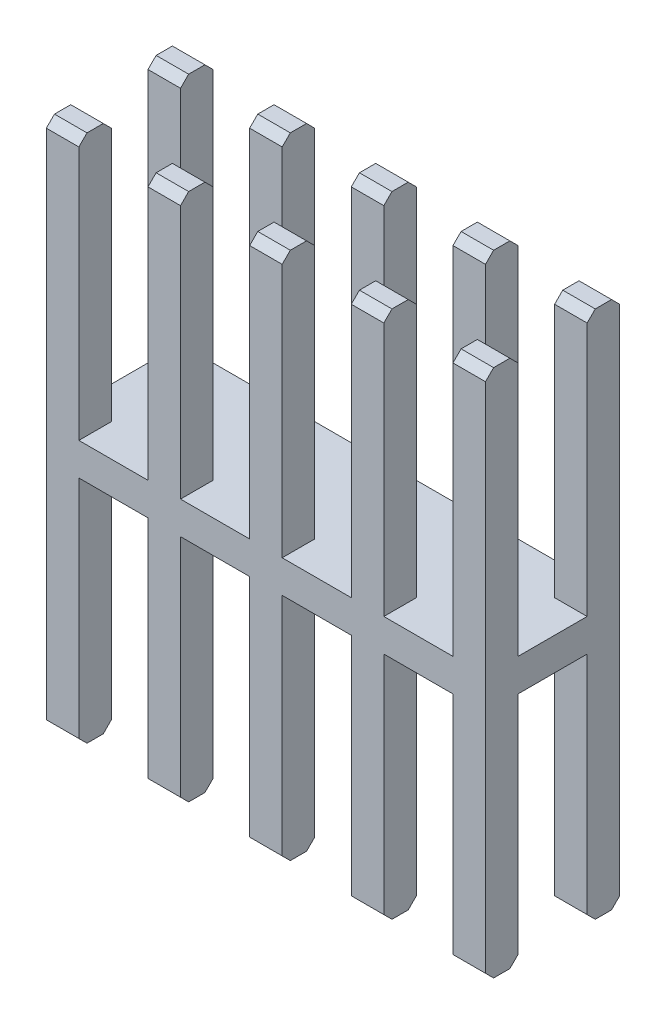
from build123d import *

# Parameters (mm, degrees)
BOSS_EXTRUDE1_DEPTH      = 2.7432
BOSS_EXTRUDE1_DEPTH_BACK = 2.7432
CUT_EXTRUDE1_DEPTH       = 2.794
CUT_EXTRUDE1_DEPTH_BACK  = 2.794
CUT_EXTRUDE2_DEPTH       = 2.794
CUT_EXTRUDE2_DEPTH_BACK  = 2.794


with BuildPart() as part:
    # Sketch1 → Boss-Extrude1 (new, two sides: drawn at the far end of the back side and taken through both)
    with BuildSketch(Plane(origin=(0, 0, 0), x_dir=(0, 0, -1), z_dir=(1, 0, 0)).offset(-BOSS_EXTRUDE1_DEPTH_BACK)):
        Polygon((-0.8382, -1.8034), (-0.7366, -1.905), (-0.5334, -1.905), (-0.4318, -1.8034), (-0.4318, 1.016), (0.4318, 1.016), (0.4318, -1.8034), (0.5334, -1.905), (0.7366, -1.905), (0.8382, -1.8034), (0.8382, 4.5974), (0.7366, 4.699), (0.5334, 4.699), (0.4318, 4.5974), (0.4318, 1.4224), (-0.4318, 1.4224), (-0.4318, 4.5974), (-0.5334, 4.699), (-0.7366, 4.699), (-0.8382, 4.5974), align=None)
    extrude(amount=BOSS_EXTRUDE1_DEPTH + BOSS_EXTRUDE1_DEPTH_BACK)

    # Sketch2 → Cut-Extrude1 (cut, two sides: drawn at the far end of the back side and taken through both)
    with BuildSketch(Plane.XY.offset(-CUT_EXTRUDE1_DEPTH_BACK)):
        Polygon((-3.6068, -2.413), (4.0132, -2.413), (4.0132, -1.905), (3.6068, -1.905), (3.6068, 1.016), (2.7432, 1.016), (2.7432, -1.905), (2.3368, -1.905), (2.3368, 1.016), (1.4732, 1.016), (1.4732, -1.905), (1.0668, -1.905), (1.0668, 1.016), (0.2032, 1.016), (0.2032, -1.905), (-0.2032, -1.905), (-0.2032, 1.016), (-1.0668, 1.016), (-1.0668, -1.905), (-1.4732, -1.905), (-1.4732, 1.016), (-2.3368, 1.016), (-2.3368, -1.905), (-2.7432, -1.905), (-2.7432, 1.016), (-3.6068, 1.016), align=None)
    extrude(amount=CUT_EXTRUDE1_DEPTH + CUT_EXTRUDE1_DEPTH_BACK, mode=Mode.SUBTRACT)

    # Sketch3 → Cut-Extrude2 (cut, two sides: drawn at the far end of the back side and taken through both)
    with BuildSketch(Plane.XY.offset(-CUT_EXTRUDE2_DEPTH_BACK)):
        Polygon((-3.6068, 5.3594), (-3.6068, 1.4224), (-2.7432, 1.4224), (-2.7432, 4.8514), (-2.3368, 4.8514), (-2.3368, 1.4224), (-1.4732, 1.4224), (-1.4732, 4.8514), (-1.0668, 4.8514), (-1.0668, 1.4224), (-0.2032, 1.4224), (-0.2032, 4.8514), (0.2032, 4.8514), (0.2032, 1.4224), (1.0668, 1.4224), (1.0668, 4.8514), (1.4732, 4.8514), (1.4732, 1.4224), (2.3368, 1.4224), (2.3368, 4.8514), (2.7432, 4.8514), (2.7432, 1.4224), (3.6068, 1.4224), (3.6068, 4.8514), (4.0132, 4.8514), (4.0132, 5.3594), align=None)
    extrude(amount=CUT_EXTRUDE2_DEPTH + CUT_EXTRUDE2_DEPTH_BACK, mode=Mode.SUBTRACT)


solid = part.part
